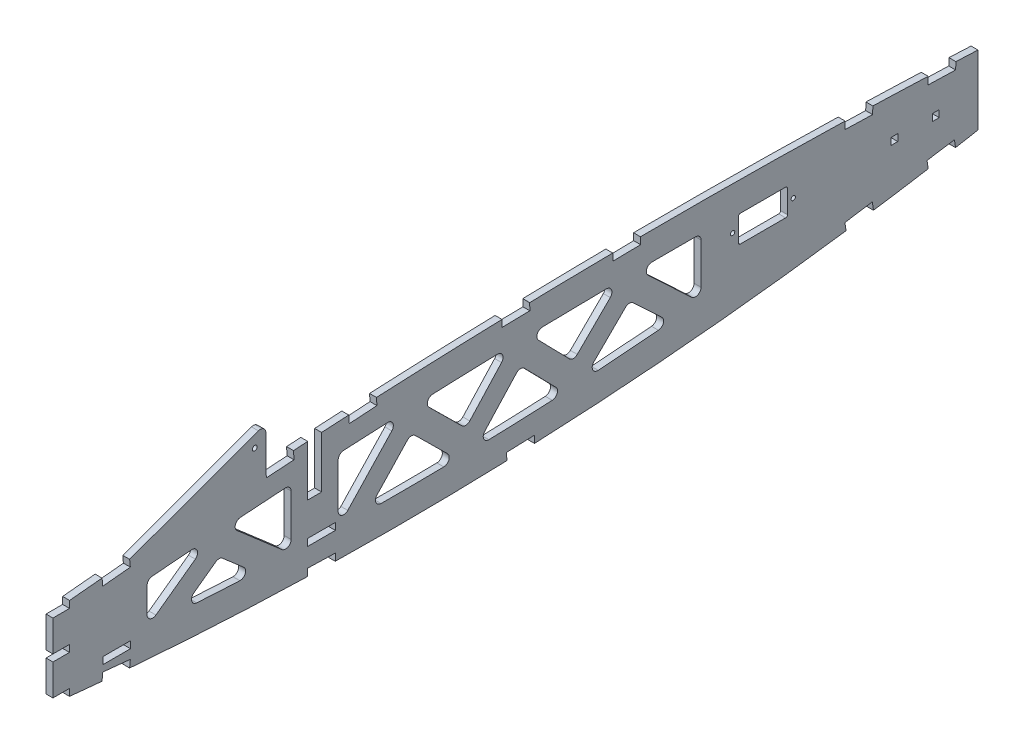
from build123d import *

# Parameters (mm, degrees)
SKETCH1_W           = 12.7
SKETCH1_H           = 3.175
BOSS_EXTRUDE1_DEPTH = 3.175
CUT_EXTRUDE1_DEPTH  = 426.444740287
FILLET1_R           = 2.54
FILLET2_R           = 2.54
CUT_EXTRUDE2_DEPTH  = 426.444740287
SKETCH5_W           = 3.175
SKETCH5_H           = 3.175
CUT_EXTRUDE3_DEPTH  = 3.175
SKETCH6_R           = 1.1
BOSS_EXTRUDE2_DEPTH = 3.175
FILLET3_R           = 2.54
CUT_EXTRUDE8_DEPTH  = 427.390694683


with BuildPart() as part:
    # Sketch1 → Boss-Extrude1 (new body)
    with BuildSketch(Plane(origin=(0, 0, 0), x_dir=(0, 0, -1), z_dir=(1, 0, 0))):
        with BuildLine():
            Line((424.18, -2.413), (424.18, 29.337))
            ThreePointArc((424.18, 29.337), (273.667143578, 32.596775123), (123.19, 27.973427581))
            Line((123.19, 27.973427581), (123.19, 4.318))
            Line((123.19, 4.318), (116.84, 4.318))
            Line((116.84, 4.318), (116.84, 27.604677315))
            ThreePointArc((116.84, 27.604677315), (62.189249287, 23.847614607), (7.62, 19.05))
            Line((7.62, 19.05), (7.62, 15.875))
            Line((7.62, 15.875), (0, 15.875))
            Line((0, 15.875), (0, 1.5875))
            Line((0, 1.5875), (7.62, 1.5875))
            Line((7.62, 1.5875), (7.62, -1.5875))
            Line((7.62, -1.5875), (0, -1.5875))
            Line((0, -1.5875), (0, -15.875))
            Line((0, -15.875), (7.62, -15.875))
            Line((7.62, -15.875), (7.62, -19.05))
            ThreePointArc((7.62, -19.05), (216.485845579, -25.4), (424.18, -2.413))
        make_face()
        with Locations((29.21, -12.5095)):
            Rectangle(SKETCH1_W, SKETCH1_H, mode=Mode.SUBTRACT)
        with Locations((123.19, -12.5095)):
            Rectangle(SKETCH1_W, SKETCH1_H, mode=Mode.SUBTRACT)
    extrude(amount=BOSS_EXTRUDE1_DEPTH)

    # Sketch2 → Cut-Extrude1 (cut, through all)
    with BuildSketch(Plane(origin=(3.175, 0, 0), x_dir=(0, 0, -1), z_dir=(1, 0, 0))):
        Polygon((72.600958908, 11.908577671), (43.18, 9.549252457), (43.18, -9.474734618), align=None)
        Polygon((79.771206325, 12.43732814), (109.22, -13.106012102), (109.22, 14.419193332), align=None)
        with BuildLine():
            ThreePointArc((209.778351211, 18.892734551), (189.021089423, 18.259412114), (168.268968759, 17.475510201))
            Line((168.268968759, 17.475510201), (189.356188172, -3.372644253))
            Line((189.356188172, -3.372644253), (209.778351211, 18.892734551))
        make_face()
        with BuildLine():
            Line((234.568877087, -11.850126894), (214.349235687, 8.845349761))
            Line((214.349235687, 8.845349761), (193.921798521, -13.425779191))
            ThreePointArc((193.921798521, -13.425779191), (214.250771517, -12.778126463), (234.568877087, -11.850126894))
        make_face()
        with BuildLine():
            Line((185.266343439, -13.616360831), (164.297385017, 7.114873352))
            Line((164.297385017, 7.114873352), (144.589305045, -13.831357718))
            ThreePointArc((144.589305045, -13.831357718), (164.928565669, -13.864136013), (185.266343439, -13.616360831))
        make_face()
        Polygon((159.709021619, 17.064873688), (130.81, 15.678534114), (130.81, -13.649715728), align=None)
        Polygon((260.048390885, 19.802273588), (218.52051909, 19.114363274), (238.624344704, -1.462572064), align=None)
        with BuildLine():
            Line((268.247772794, 19.866853456), (297.18, -7.219164077))
            Line((297.18, -7.219164077), (297.18, 19.90706301))
            ThreePointArc((297.18, 19.90706301), (282.713835593, 19.923513628), (268.247772794, 19.866853456))
        make_face()
        Polygon((264.267865598, 9.675269656), (243.141210485, -11.294394819), (283.422085896, -8.256690547), align=None)
        with BuildLine():
            Line((76.275980028, 2.019582146), (58.90074433, -10.60883327))
            ThreePointArc((58.90074433, -10.60883327), (75.946592538, -11.647866979), (93.003331134, -12.489413548))
            Line((93.003331134, -12.489413548), (76.275980028, 2.019582146))
        make_face()
    extrude(amount=-CUT_EXTRUDE1_DEPTH, mode=Mode.SUBTRACT)

    # Fillet1
    fillet1_edges = [part.edges().sort_by_distance(p)[0] for p in [
        (1.5875, 12.43732814, -79.771206325),
        (1.5875, 14.419193332, -109.22),
        (1.5875, -13.106012102, -109.22),
        (1.5875, -10.60883327, -58.90074433),
        (1.5875, 2.019582146, -76.275980028),
        (1.5875, -12.489413548, -93.003331134),
        (1.5875, -9.474734618, -43.18),
        (1.5875, 9.549252457, -43.18),
        (1.5875, 11.908577671, -72.600958908),
    ]]
    fillet(fillet1_edges, radius=FILLET1_R)

    # Fillet2
    fillet2_edges = [part.edges().sort_by_distance(p)[0] for p in [
        (1.5875, -13.831357718, -144.589305045),
        (1.5875, 7.114873352, -164.297385017),
        (1.5875, -13.616360831, -185.266343439),
        (1.5875, -13.649715728, -130.81),
        (1.5875, 15.678534114, -130.81),
        (1.5875, 17.064873688, -159.709021619),
        (1.5875, -11.294394819, -243.141210485),
        (1.5875, 9.675269656, -264.267865598),
        (1.5875, -8.256690547, -283.422085896),
        (1.5875, 19.90706301, -297.18),
        (1.5875, -7.219164077, -297.18),
        (1.5875, 19.866853456, -268.247772794),
        (1.5875, -13.425779191, -193.921798521),
        (1.5875, 8.845349761, -214.349235687),
        (1.5875, -11.850126894, -234.568877087),
        (1.5875, 19.114363274, -218.52051909),
        (1.5875, 19.802273588, -260.048390885),
        (1.5875, -1.462572064, -238.624344704),
        (1.5875, -3.372644253, -189.356188172),
        (1.5875, 17.475510201, -168.268968759),
        (1.5875, 18.892734551, -209.778351211),
    ]]
    fillet(fillet2_edges, radius=FILLET2_R)

    # Sketch4 → Cut-Extrude2 (cut, through all)
    with BuildSketch(Plane(origin=(3.175, 0, 0), x_dir=(0, 0, -1), z_dir=(1, 0, 0))):
        Polygon((401.34520792, 30.3392694), (401.246310067, 26.911695883), (413.941026796, 26.545407535), (414.03992465, 29.972981052), align=None)
        with BuildLine():
            Line((363.662294502, -12.174897717), (363.168479187, -8.653352256))
            Line((363.168479187, -8.653352256), (375.718961202, -6.710313089))
            Line((375.718961202, -6.710313089), (376.26161421, -10.353116503))
            ThreePointArc((376.26161421, -10.353116503), (369.963903636, -11.277488202), (363.662294502, -12.174897717))
        make_face()
        with BuildLine():
            Line((208.02116937, -22.355732482), (208.136264363, -25.709984865))
            ThreePointArc((208.136264363, -25.709984865), (214.482122389, -25.478673785), (220.826934928, -25.220269528))
            Line((220.826934928, -25.220269528), (220.713699521, -21.920211688))
            Line((220.713699521, -21.920211688), (208.02116937, -22.355732482))
        make_face()
        with BuildLine():
            Line((363.168479187, 28.229573744), (375.863195917, 27.863285396))
            Line((375.863195917, 27.863285396), (375.960628617, 31.240080046))
            ThreePointArc((375.960628617, 31.240080046), (369.613472503, 31.430233755), (363.265911888, 31.606368394))
            Line((363.265911888, 31.606368394), (363.168479187, 28.229573744))
        make_face()
        with BuildLine():
            Line((400.820335888, -2.82417118), (413.370817903, -0.881132013))
            Line((413.370817903, -0.881132013), (413.873664765, -4.256718697))
            ThreePointArc((413.873664765, -4.256718697), (407.615334423, -5.339793677), (401.352435746, -6.396131805))
            Line((401.352435746, -6.396131805), (400.820335888, -2.82417118))
        make_face()
        with BuildLine():
            Line((35.495657605, -18.289383461), (22.86, -17.012607481))
            Line((22.86, -17.012607481), (22.50974331, -20.478934921))
            ThreePointArc((22.50974331, -20.478934921), (28.83554985, -21.040303338), (35.16369585, -21.574654438))
            Line((35.16369585, -21.574654438), (35.495657605, -18.289383461))
        make_face()
        with BuildLine():
            Line((22.86, 17.084786054), (35.500029686, 18.317526718))
            Line((35.500029686, 18.317526718), (35.179517113, 21.603934436))
            ThreePointArc((35.179517113, 21.603934436), (28.854300978, 21.041432014), (22.530342672, 20.464960433))
            Line((22.530342672, 20.464960433), (22.86, 17.084786054))
        make_face()
        with BuildLine():
            Line((97.88076218, 22.601533179), (110.553273442, 23.436672879))
            Line((110.553273442, 23.436672879), (110.304576067, 27.210437063))
            ThreePointArc((110.304576067, 27.210437063), (103.96695249, 26.813860119), (97.63022027, 26.403286558))
            Line((97.63022027, 26.403286558), (97.88076218, 22.601533179))
        make_face()
        with BuildLine():
            Line((148.570807227, 25.94209198), (135.898295966, 25.10695228))
            Line((135.898295966, 25.10695228), (135.664355517, 28.656793069))
            ThreePointArc((135.664355517, 28.656793069), (142.006714796, 28.983394505), (148.349780034, 29.29598546))
            Line((148.349780034, 29.29598546), (148.570807227, 25.94209198))
        make_face()
        with BuildLine():
            Line((116.84, -22.735530323), (129.535316808, -23.080394262))
            Line((129.535316808, -23.080394262), (129.447124684, -26.32697019))
            ThreePointArc((129.447124684, -26.32697019), (123.098419769, -26.195194562), (116.750335376, -26.036312694))
            Line((116.750335376, -26.036312694), (116.84, -22.735530323))
        make_face()
    extrude(amount=-CUT_EXTRUDE2_DEPTH, mode=Mode.SUBTRACT)

    # Sketch5 → Cut-Extrude3 (cut)
    with BuildSketch(Plane.ZY):
        with Locations((-404.8125, 12.9667)):
            Rectangle(SKETCH5_W, SKETCH5_H)
        with Locations((-385.808582885, 12.9667)):
            Rectangle(SKETCH5_W, SKETCH5_H)
    extrude(amount=-CUT_EXTRUDE3_DEPTH, mode=Mode.SUBTRACT)

    # Sketch6 → Boss-Extrude2 (add)
    with BuildSketch(Plane(origin=(0, 0, 0), x_dir=(0, 0, -1), z_dir=(1, 0, 0))):
        with BuildLine():
            ThreePointArc((97.63022027, 26.403286558), (66.391798757, 24.173680663), (35.179517113, 21.603934436))
            Line((35.179517113, 21.603934436), (97.63022027, 44.334131494))
            Line((97.63022027, 44.334131494), (97.63022027, 26.403286558))
        make_face()
        with Locations((92.55022027, 37.07913962)):
            Circle(SKETCH6_R, mode=Mode.SUBTRACT)
    extrude(amount=BOSS_EXTRUDE2_DEPTH)

    # Fillet3
    fillet3_edges = [part.edges().sort_by_distance(p)[0] for p in [
        (1.5875, 44.334131494, -97.63022027),
    ]]
    fillet(fillet3_edges, radius=FILLET3_R)

    # Sketch7 → Cut-Extrude8 (cut, through all)
    with BuildSketch(Plane(origin=(3.175, 0, 0), x_dir=(0, 0, -1), z_dir=(1, 0, 0))):
        Polygon((256.711845862, 32.357756288), (256.657958101, 35.51720074), (269.356111225, 35.733781549), (269.409998986, 32.574337097), (269.464144188, 29.399798816), (256.765991064, 29.183218007), align=None)
        Polygon((205.919233367, 31.491433052), (205.866908215, 34.559261619), (218.569507098, 34.775918255), (218.617386491, 31.968744967), (218.617386491, 31.708013861), (218.671531693, 28.53347558), (205.973378569, 28.316894771), align=None)
        with BuildLine():
            Line((336.825, 7.6492), (336.825, 18.1492))
            ThreePointArc((336.825, 18.1492), (336.576040764, 18.750240764), (335.975, 18.9992))
            Line((335.975, 18.9992), (315.175, 18.9992))
            ThreePointArc((315.175, 18.9992), (314.573959236, 18.750240764), (314.325, 18.1492))
            Line((314.325, 18.1492), (314.325, 7.6492))
            ThreePointArc((314.325, 7.6492), (314.573959236, 7.048159236), (315.175, 6.7992))
            Line((315.175, 6.7992), (335.975, 6.7992))
            ThreePointArc((335.975, 6.7992), (336.576040764, 7.048159236), (336.825, 7.6492))
        make_face()
        with BuildLine():
            ThreePointArc((311.675, 11.919687365), (312.367620027, 12.206579973), (312.654512635, 12.8992))
            ThreePointArc((312.654512635, 12.8992), (312.367620027, 13.591820027), (311.675, 13.878712635))
            ThreePointArc((311.675, 13.878712635), (310.982379973, 13.591820027), (310.695487365, 12.8992))
            ThreePointArc((310.695487365, 12.8992), (310.982379973, 12.206579973), (311.675, 11.919687365))
        make_face()
        with BuildLine():
            ThreePointArc((339.475, 13.878712635), (338.782379973, 13.591820027), (338.495487365, 12.8992))
            ThreePointArc((338.495487365, 12.8992), (338.782379973, 12.206579973), (339.475, 11.919687365))
            ThreePointArc((339.475, 11.919687365), (340.167620027, 12.206579973), (340.454512635, 12.8992))
            ThreePointArc((340.454512635, 12.8992), (340.167620027, 13.591820027), (339.475, 13.878712635))
        make_face()
    extrude(amount=-CUT_EXTRUDE8_DEPTH, mode=Mode.SUBTRACT)


solid = part.part
